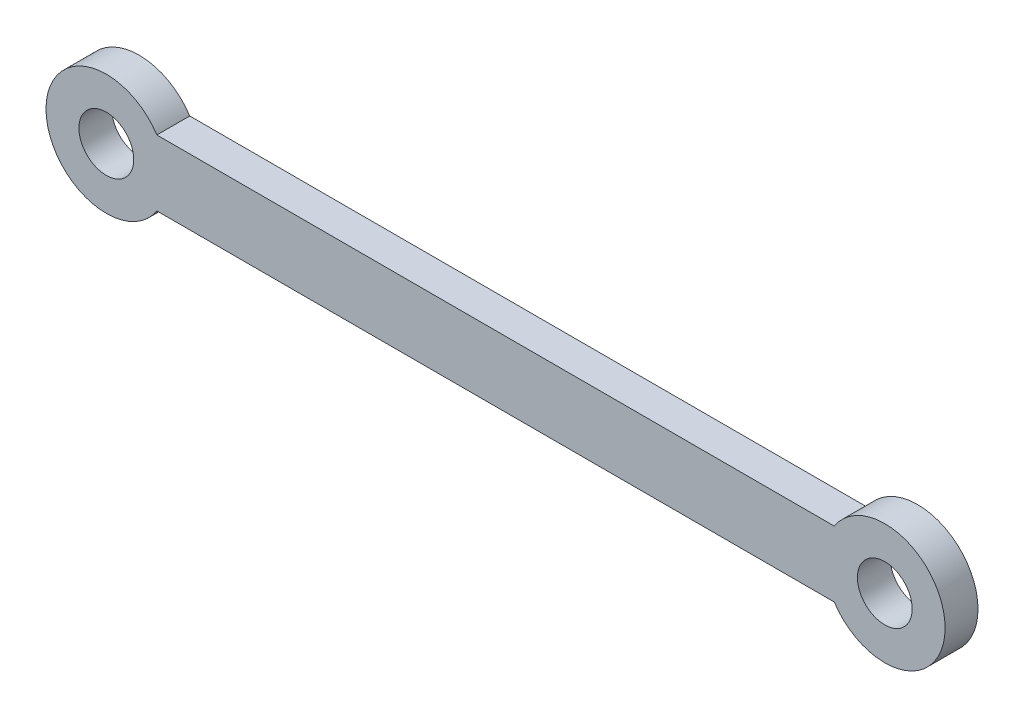
from build123d import *

# Parameters (mm, degrees)
SKETCH_1_R      = 2.5
EXTRUDE_1_DEPTH = 3


with BuildPart() as part:
    # 草图1 → 凸台-拉伸1 (new body)
    with BuildSketch(Plane.XY):
        with BuildLine():
            ThreePointArc((4.609772229, 3), (-5.5, 0), (4.609772229, -3))
            Line((4.609772229, -3), (66.390227771, -3))
            ThreePointArc((66.390227771, -3), (76.5, 0), (66.390227771, 3))
            Line((66.390227771, 3), (4.609772229, 3))
        make_face()
        Circle(SKETCH_1_R, mode=Mode.SUBTRACT)
        with Locations((71, 0)):
            Circle(SKETCH_1_R, mode=Mode.SUBTRACT)
    extrude(amount=EXTRUDE_1_DEPTH)


solid = part.part
